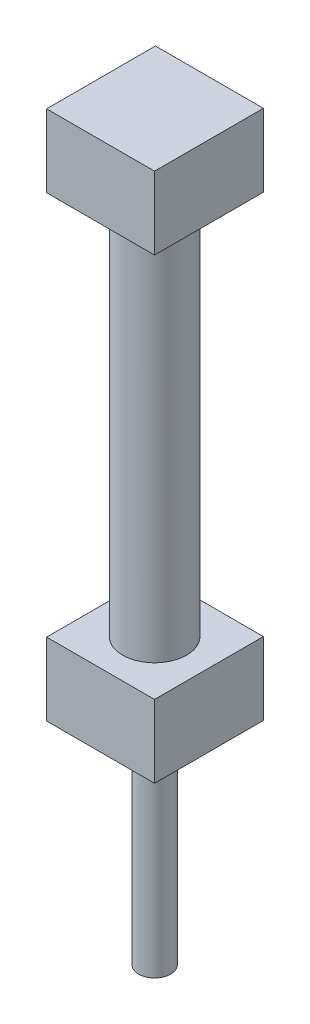
from build123d import *

# Parameters (mm, degrees)
SKETCH1_R           = 15
BOSS_EXTRUDE2_DEPTH = 194
SKETCH2_W           = 50.475671087
SKETCH2_H           = 50.915354634
BOSS_EXTRUDE3_DEPTH = 34
SKETCH3_R           = 7.5
BOSS_EXTRUDE4_DEPTH = 99


with BuildPart() as part:
    # Sketch1 → Boss-Extrude2 (new body)
    with BuildSketch(Plane(origin=(0, 0, 0), x_dir=(1, 0, 0), z_dir=(0, 1, 0))):
        with Locations(Location((0, 0, 0), (0, 0, 270))):
            Circle(SKETCH1_R)
    extrude(amount=BOSS_EXTRUDE2_DEPTH)

    # Sketch2 → Boss-Extrude3 (add)
    with BuildSketch(Plane.XZ):
        with Locations((0.175873419, 0)):
            Rectangle(SKETCH2_W, SKETCH2_H)
    boss_extrude3 = extrude(amount=BOSS_EXTRUDE3_DEPTH)

    # Mirror1: Boss-Extrude3 across plane
    add(boss_extrude3.mirror(Plane.ZX.offset(90)))

    # Sketch3 → Boss-Extrude4 (add)
    with BuildSketch(Plane.XZ.offset(34)):
        with Locations(Location((0, 0, 0), (0, 0, 90))):
            Circle(SKETCH3_R)
    extrude(amount=BOSS_EXTRUDE4_DEPTH)


solid = part.part
